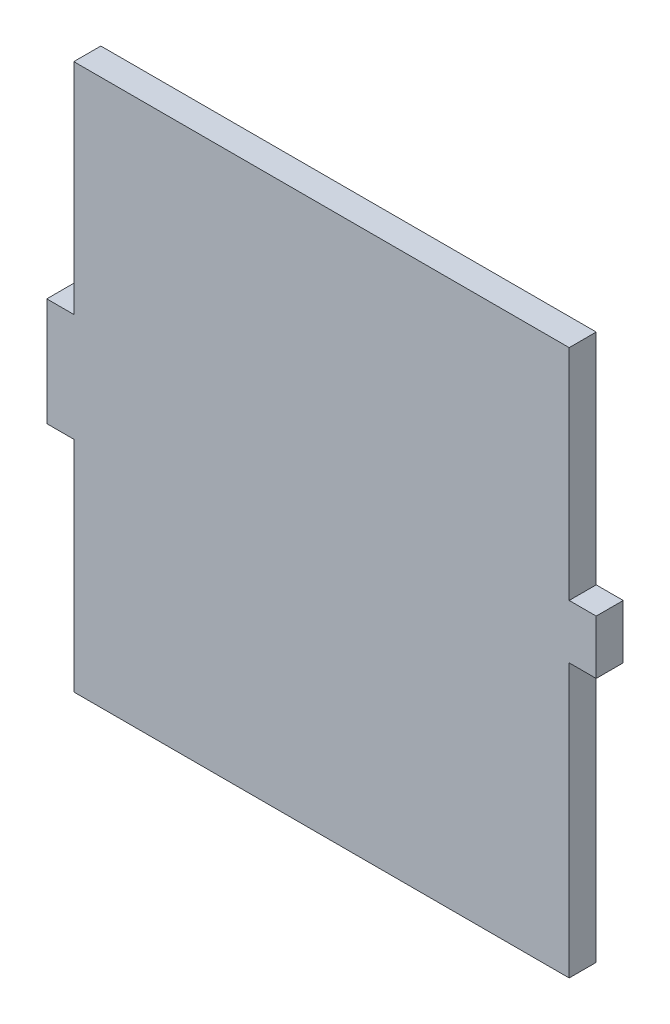
from build123d import *

# Parameters (mm, degrees)
P_IDAT_VYSUNUT_M1_DEPTH = 3


with BuildPart() as part:
    # Skica1 → Přidat vysunutím1 (new body)
    with BuildSketch(Plane.XY):
        Polygon((55, -30.31), (55, -60.61), (0, -60.61), (0, -36.31), (-3, -36.31), (-3, -24.31), (0, -24.31), (0, 0), (55, 0), (55, -24.31), (58, -24.31), (58, -30.31), align=None)
    extrude(amount=P_IDAT_VYSUNUT_M1_DEPTH)


solid = part.part
